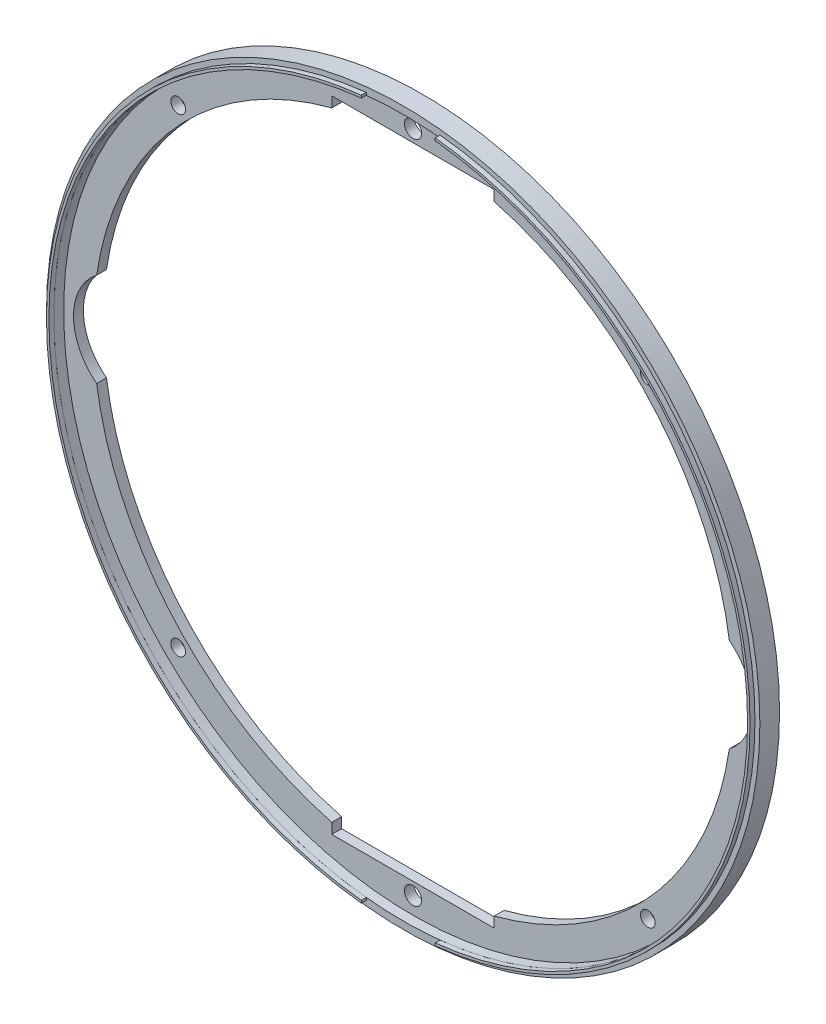
from build123d import *

# Parameters (mm, degrees)
SKIZZE4_R               = 72.5
SKIZZE4_R_2             = 65
BASE_RING_DEPTH         = 2
SPACER_PLACEMENT_D      = 3
SKIZZE8_R               = 12
BALL_CASTOR_DEPTH       = 103.549987811
SKIZZE9_W               = 33
SKIZZE9_H               = 130
SKIZZE9_H_2             = 100
WHEELS_DEPTH            = 103.549987811
SKIZZE11_R              = 72.5
SKIZZE11_R_2            = 71
SIDE_WALL_DEPTH         = 2
SKIZZE14_R              = 71.5
SKIZZE14_R_2            = 71
INNER_WALL_DEPTH        = 1
SKIZZE13_W              = 1.75
SKIZZE13_H              = 2
COVER_SCREWS_AT_2_COUNT = 2
COVER_SCREWS_AT_2_PITCH = 135
SKIZZE15_W              = 15
SKIZZE15_H              = 145
COVER_OPENING_DEPTH     = 1


with BuildPart() as part:
    # Skizze4 → Base Ring (new body)
    with BuildSketch(Plane.XY):
        Circle(SKIZZE4_R)
        Circle(SKIZZE4_R_2, mode=Mode.SUBTRACT)
    extrude(amount=BASE_RING_DEPTH)

    # Spacer Placement (through all)
    with Locations(Plane.XY.offset(2)):
        with Locations((-47.72970773, 47.72970773), (47.72970773, 47.72970773), (47.72970773, -47.72970773), (-47.72970773, -47.72970773)):
            Hole(SPACER_PLACEMENT_D / 2)

    # Skizze8 → Ball Castor (cut, through all)
    with BuildSketch(Plane.XY.offset(2)):
        with Locations((57, 0)):
            Circle(SKIZZE8_R)
        with Locations((-57, 0)):
            Circle(SKIZZE8_R)
    extrude(amount=-BALL_CASTOR_DEPTH, mode=Mode.SUBTRACT)

    # Skizze9 → Wheels (cut, through all)
    with BuildSketch(Plane.XY):
        Rectangle(SKIZZE9_W, SKIZZE9_H)
        Rectangle(SKIZZE9_W, SKIZZE9_H_2)
    extrude(amount=WHEELS_DEPTH, mode=Mode.SUBTRACT)

    # Skizze11 → Side Wall (add)
    with BuildSketch(Plane.XY.offset(2)):
        Circle(SKIZZE11_R)
        Circle(SKIZZE11_R_2, mode=Mode.SUBTRACT)
    extrude(amount=SIDE_WALL_DEPTH)

    # Skizze13 → Cover Screws (revolve, cut)
    with BuildSketch(Plane(origin=(0, -67.5, 2), x_dir=(0, -1, 0), z_dir=(1, 0, 0))):
        with Locations((0.875, 1)):
            Rectangle(SKIZZE13_W, SKIZZE13_H)
    cover_screws = revolve(axis=Axis((0, -67.5, 8.35), (0, 0, -1)), mode=Mode.SUBTRACT)

    # Cover Screws at 2: Cover Screws ×2
    with Locations(*[(0, i * COVER_SCREWS_AT_2_PITCH, 0) for i in range(1, COVER_SCREWS_AT_2_COUNT)]):
        add(cover_screws, mode=Mode.SUBTRACT)


with BuildPart() as body_2:
    # Skizze14 → Inner Wall (new body)
    with BuildSketch(Plane.XY.offset(4)):
        Circle(SKIZZE14_R)
        Circle(SKIZZE14_R_2, mode=Mode.SUBTRACT)
    extrude(amount=INNER_WALL_DEPTH)

    # Skizze15 → Cover Opening (cut)
    with BuildSketch(Plane.XY.offset(5)):
        Rectangle(SKIZZE15_W, SKIZZE15_H)
    extrude(amount=-COVER_OPENING_DEPTH, mode=Mode.SUBTRACT)


with BuildPart() as cover_opening_piece_1:
    # of the separate pieces the step leaves, piece 1, a body of its own (cover_opening_pieces)
    add(body_2.part.solids().sort_by_distance((7.5, -71.105555339, 4))[0])


with BuildPart() as cover_opening_piece_2:
    # of the separate pieces the step leaves, piece 2, a body of its own (cover_opening_pieces)
    add(body_2.part.solids().sort_by_distance((-7.5, 71.105555339, 4))[0])


solid = Compound([part.part, cover_opening_piece_1.part, cover_opening_piece_2.part])
